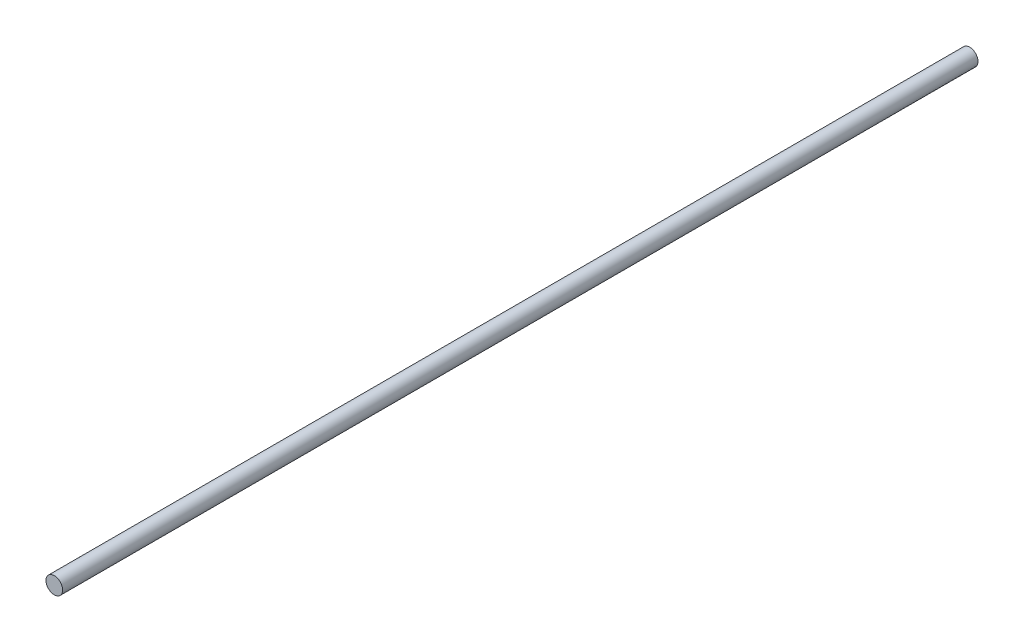
from build123d import *

# Parameters (mm, degrees)
KAP_TARAK_MILI_D12_START = -40
SKETCH1_R                = 6
KAP_TARAK_MILI_D12_DEPTH = 660


with BuildPart() as part:
    # Sketch1 → KAP_tarak_mili_D12 (new body)
    with BuildSketch(Plane.XY.offset(KAP_TARAK_MILI_D12_START)):
        with Locations((0, 170)):
            Circle(SKETCH1_R)
    extrude(amount=-KAP_TARAK_MILI_D12_DEPTH)


solid = part.part
